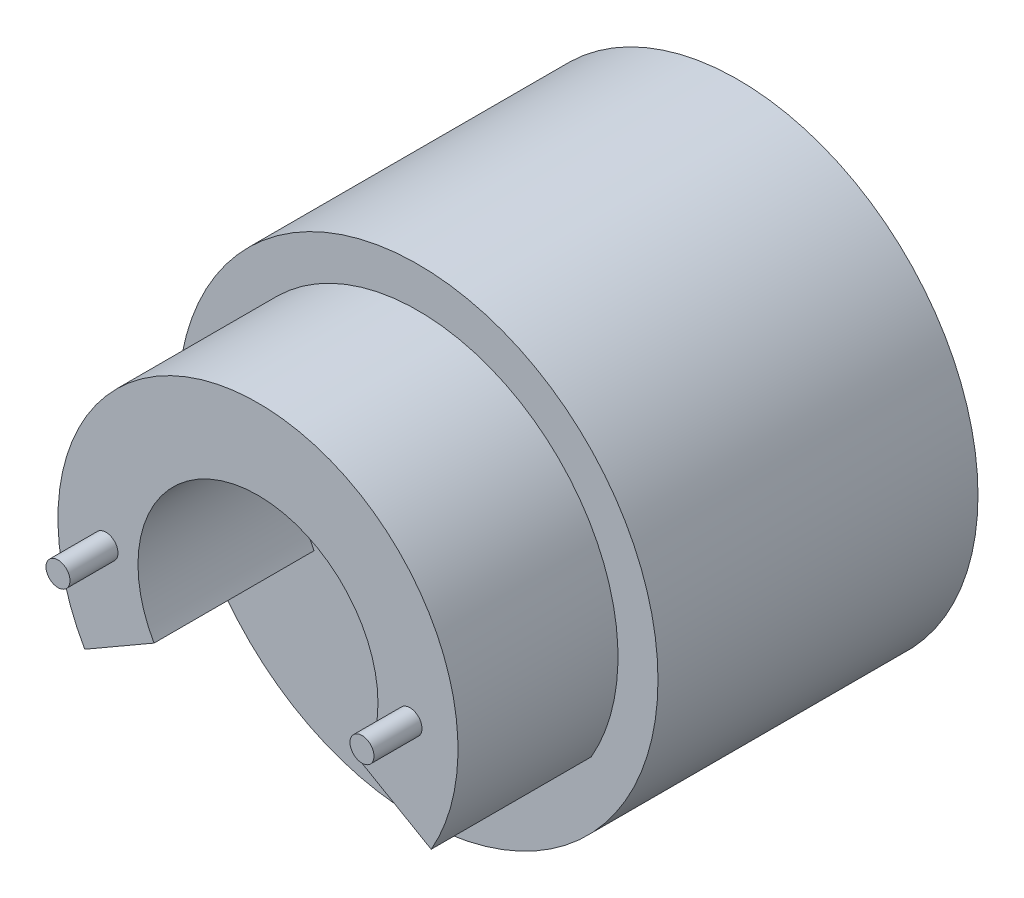
from build123d import *

# Parameters (mm, degrees)
SKETCH1_R           = 15
BOSS_EXTRUDE1_DEPTH = 20
BOSS_EXTRUDE2_DEPTH = 10
SKETCH3_R           = 0.75
BOSS_EXTRUDE3_DEPTH = 3


with BuildPart() as part:
    # Sketch1 → Boss-Extrude1 (new body)
    with BuildSketch(Plane.XY):
        Circle(SKETCH1_R)
    extrude(amount=BOSS_EXTRUDE1_DEPTH)

    # Sketch2 → Boss-Extrude2 (add)
    with BuildSketch(Plane.XY.offset(20)):
        with BuildLine():
            Line((-6.495190528, -3.75), (-10.825317547, -6.25))
            ThreePointArc((-10.825317547, -6.25), (0, 12.5), (10.825317547, -6.25))
            Line((10.825317547, -6.25), (6.495190528, -3.75))
            ThreePointArc((6.495190528, -3.75), (0, 7.5), (-6.495190528, -3.75))
        make_face()
    extrude(amount=BOSS_EXTRUDE2_DEPTH)

    # Sketch3 → Boss-Extrude3 (add)
    with BuildSketch(Plane.XY.offset(30)):
        with Locations((9.5, 0)):
            Circle(SKETCH3_R)
        with Locations((-9.5, 0)):
            Circle(SKETCH3_R)
    extrude(amount=BOSS_EXTRUDE3_DEPTH)


solid = part.part
